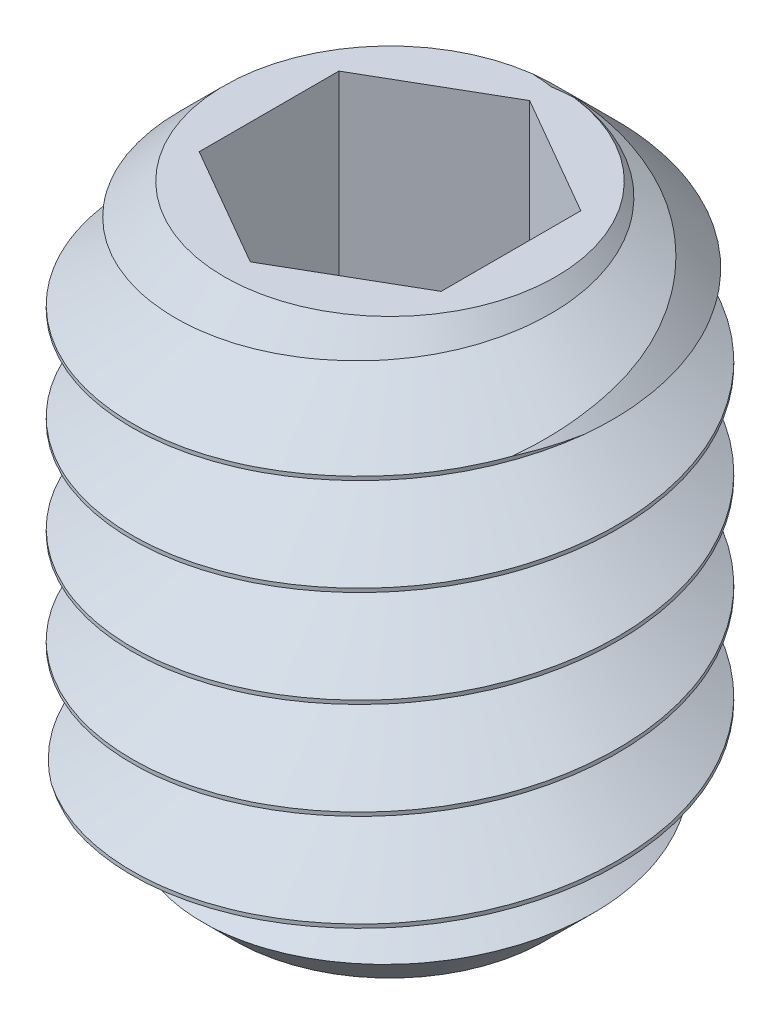
from build123d import *

# Parameters (mm, degrees)
CUT_EXTRUDE1_DEPTH     = 1.778
CUT_SWEEP3_PITCH       = 0.79502
CUT_SWEEP3_HEIGHT      = 9.525
CUT_SWEEP3_RADIUS      = 1.9939
CUT_SWEEP3_START_ANGLE = -180


with BuildPart() as part:
    # Sketch1 → Revolve1 (revolve)
    with BuildSketch(Plane.XY, mode=Mode.PRIVATE) as revolve1_sk:
        Polygon((0, 0.586587873), (-1.016, 0), (-1.27, 0), (-1.9939, 0.7239), (-1.9939, 4.1275), (-1.3589, 4.7625), (0, 4.7625), align=None)
    revolve(revolve1_sk.sketch.rotate(Axis((0, 0, 0), (0, 1, 0)), 270), axis=Axis((0, 0, 0), (0, 1, 0)))

    # Sketch2 → Cut-Extrude1 (cut)
    with BuildSketch(Plane(origin=(0, 4.7625, 0), x_dir=(1, 0, 0), z_dir=(0, 1, 0))):
        Polygon((0, 1.14567944), (-0.9921875, 0.57283972), (-0.9921875, -0.57283972), (0, -1.14567944), (0.9921875, -0.57283972), (0.9921875, 0.57283972), align=None)
    extrude(amount=-CUT_EXTRUDE1_DEPTH, mode=Mode.SUBTRACT)

    # Cut-Sweep3: sweep along a helix
    with BuildLine() as cut_sweep3_path:
        add(Helix(CUT_SWEEP3_PITCH, CUT_SWEEP3_HEIGHT, CUT_SWEEP3_RADIUS, center=(0, 4.7625, 0), direction=(0, -1, 0), mode=Mode.PRIVATE).rotate(Axis((0, 4.7625, 0), (0, -1, 0)), CUT_SWEEP3_START_ANGLE))
    # Sketch4 → Cut-Sweep3 (sweep, cut)
    with BuildSketch(Plane(origin=(0, 0, 0), x_dir=(0, 0, -1), z_dir=(1, 0, 0))):
        Polygon((-2.0193, 5.55625), (-2.0193, 4.7625), (-1.331892336, 5.159375), align=None)
    sweep(path=cut_sweep3_path.line, is_frenet=True, mode=Mode.SUBTRACT)


solid = part.part
